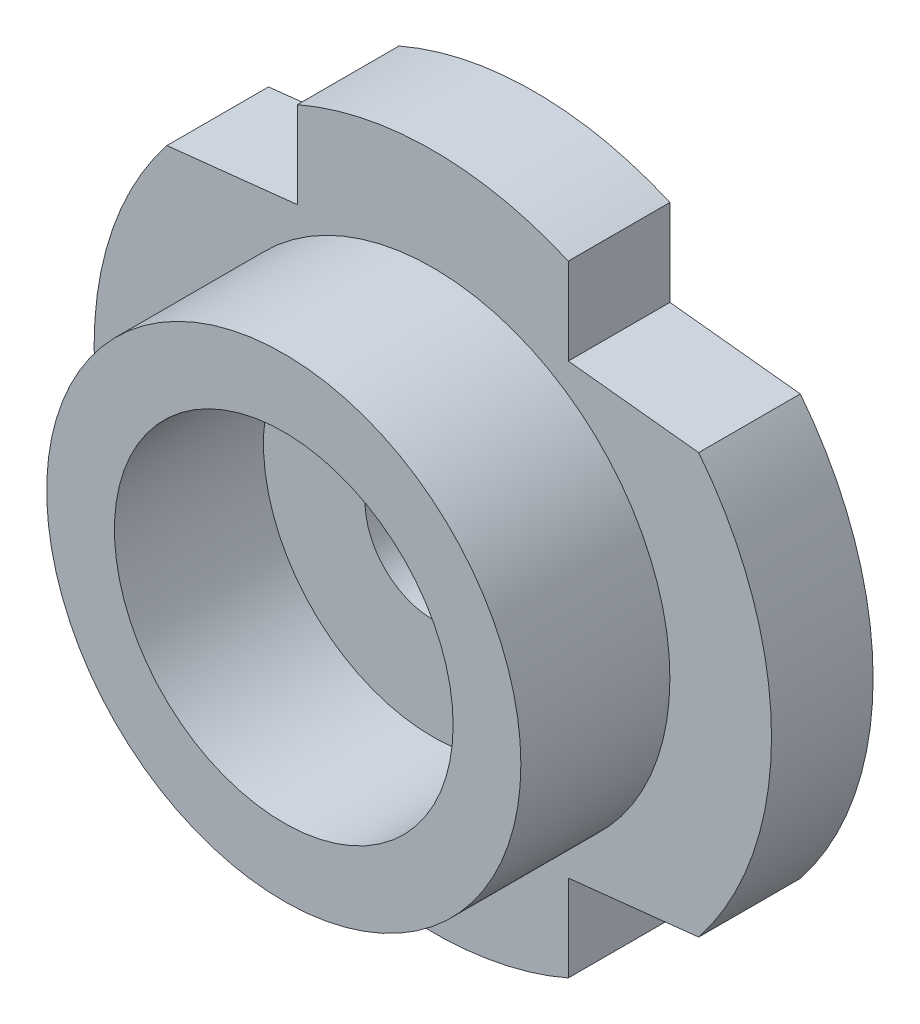
from build123d import *

# Parameters (mm, degrees)
BOSS_EXTRUDE1_DEPTH = 1.5
SKETCH2_R           = 3.5
SKETCH2_R_2         = 2.5
BOSS_EXTRUDE2_DEPTH = 2.2
CUT_EXTRUDE1_REACH  = 20.87
SKETCH3_R           = 1
SKETCH4_R           = 2.5
CUT_EXTRUDE2_DEPTH  = 1
CUT_EXTRUDE4_START  = -1.5
SKETCH5_R           = 17.5
SKETCH5_R_2         = 5
CUT_EXTRUDE4_DEPTH  = 1.5


with BuildPart() as part:
    # Sketch1 → Boss-Extrude1 (new body)
    with BuildSketch(Plane.XY):
        with BuildLine():
            Line((2, 7.75863865), (2, 3.304737557))
            Line((2, 3.304737557), (14.214285714, 1.988487272))
            ThreePointArc((14.214285714, 1.988487272), (16, 0), (14.214285714, -1.988487272))
            Line((14.214285714, -1.988487272), (2, -3.304737557))
            Line((2, -3.304737557), (2, -7.75863865))
            ThreePointArc((2, -7.75863865), (0, -9.75863865), (-2, -7.75863865))
            Line((-2, -7.75863865), (-2, -3.304737557))
            Line((-2, -3.304737557), (-14.214285714, -1.988487272))
            ThreePointArc((-14.214285714, -1.988487272), (-16, 0), (-14.214285714, 1.988487272))
            Line((-14.214285714, 1.988487272), (-2, 3.304737557))
            Line((-2, 3.304737557), (-2, 7.75863865))
            ThreePointArc((-2, 7.75863865), (0, 9.75863865), (2, 7.75863865))
        make_face()
    extrude(amount=BOSS_EXTRUDE1_DEPTH)

    # Sketch2 → Boss-Extrude2 (add)
    with BuildSketch(Plane.XY.offset(1.5)):
        Circle(SKETCH2_R)
        Circle(SKETCH2_R_2, mode=Mode.SUBTRACT)
    extrude(amount=BOSS_EXTRUDE2_DEPTH)

    # Sketch3 → Cut-Extrude1 (cut, up to next)
    with BuildSketch(Plane.XY.offset(1.5), mode=Mode.PRIVATE) as cut_extrude1_sk1:
        Circle(SKETCH3_R)
    cut_extrude1_tool1 = extrude(cut_extrude1_sk1.sketch, amount=-CUT_EXTRUDE1_REACH, mode=Mode.PRIVATE) & part.part
    add(cut_extrude1_tool1.solids().sort_by_distance((0, 0, 1.5))[0], mode=Mode.SUBTRACT)

    # Sketch4 → Cut-Extrude2 (cut)
    with BuildSketch(Plane(origin=(0, 0, 0), x_dir=(-1, 0, 0), z_dir=(0, 0, -1))):
        with Locations(Location((0, 0, 0), (0, 0, 180))):
            Circle(SKETCH4_R)
    extrude(amount=-CUT_EXTRUDE2_DEPTH, mode=Mode.SUBTRACT)

    # Sketch5 → Cut-Extrude4 (cut)
    with BuildSketch(Plane.XY.offset(1.5).offset(CUT_EXTRUDE4_START)):
        Circle(SKETCH5_R)
        Circle(SKETCH5_R_2, mode=Mode.SUBTRACT)
    extrude(amount=CUT_EXTRUDE4_DEPTH, mode=Mode.SUBTRACT)


solid = part.part
